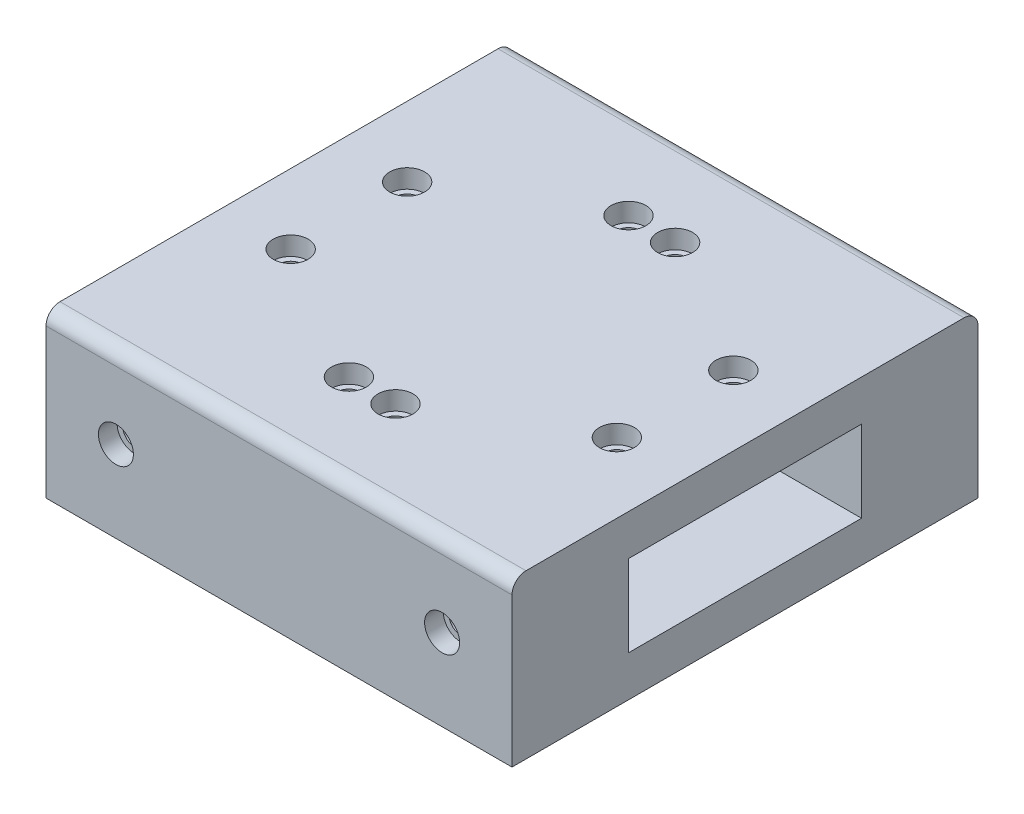
from build123d import *

# Parameters (mm, degrees)
SKETCH1_W           = 100
SKETCH1_H           = 100
BOSS_EXTRUDE1_DEPTH = 35
SKETCH2_W           = 50
SKETCH2_H           = 17.5
CUT_EXTRUDE1_DEPTH  = 30
SKETCH3_R           = 2.5
CUT_EXTRUDE2_DEPTH  = 10
SKETCH4_R           = 3.75
CUT_EXTRUDE3_DEPTH  = 4
SKETCH5_R           = 2.5
CUT_EXTRUDE4_DEPTH  = 30
SKETCH6_R           = 3.75
CUT_EXTRUDE5_DEPTH  = 4
SKETCH7_R           = 2.5
CUT_EXTRUDE10_DEPTH = 79.89866919
SKETCH8_R           = 3.75
CUT_EXTRUDE11_DEPTH = 4
FILLET1_R           = 3


with BuildPart() as part:
    # Sketch1 → Boss-Extrude1 (new body)
    with BuildSketch(Plane(origin=(0, 0, 0), x_dir=(1, 0, 0), z_dir=(0, 1, 0))):
        Rectangle(SKETCH1_W, SKETCH1_H)
    extrude(amount=BOSS_EXTRUDE1_DEPTH)

    # Sketch2 → Cut-Extrude1 (cut)
    with BuildSketch(Plane(origin=(50, 0, 0), x_dir=(0, 0, -1), z_dir=(1, 0, 0))):
        with Locations((0, 17.5)):
            Rectangle(SKETCH2_W, SKETCH2_H)
    cut_extrude1 = extrude(amount=-CUT_EXTRUDE1_DEPTH, mode=Mode.SUBTRACT)

    # Mirror1: Cut-Extrude1 across plane
    add(cut_extrude1.mirror(Plane(origin=(0, 0, 0), x_dir=(0, 0, 1), z_dir=(1, 0, 0))), mode=Mode.SUBTRACT)

    # Sketch3 → Cut-Extrude2 (cut)
    with BuildSketch(Plane(origin=(0, 35, 0), x_dir=(1, 0, 0), z_dir=(0, 1, 0))):
        with Locations(Location((35, 12.5, 0), (0, 0, 270))):
            Circle(SKETCH3_R)
        with Locations(Location((35, -12.5, 0), (0, 0, 270))):
            Circle(SKETCH3_R)
        with Locations(Location((-35, -12.5, 0), (0, 0, 270))):
            Circle(SKETCH3_R)
        with Locations(Location((-35, 12.5, 0), (0, 0, 90))):
            Circle(SKETCH3_R)
    extrude(amount=-CUT_EXTRUDE2_DEPTH, mode=Mode.SUBTRACT)

    # Sketch4 → Cut-Extrude3 (cut)
    with BuildSketch(Plane(origin=(0, 35, 0), x_dir=(1, 0, 0), z_dir=(0, 1, 0))):
        with Locations(Location((35, 12.5, 0), (0, 0, 270))):
            Circle(SKETCH4_R)
        with Locations(Location((35, -12.5, 0), (0, 0, 90))):
            Circle(SKETCH4_R)
        with Locations(Location((-35, -12.5, 0), (0, 0, 270))):
            Circle(SKETCH4_R)
        with Locations(Location((-35, 12.5, 0), (0, 0, 90))):
            Circle(SKETCH4_R)
    extrude(amount=-CUT_EXTRUDE3_DEPTH, mode=Mode.SUBTRACT)

    # Sketch5 → Cut-Extrude4 (cut)
    with BuildSketch(Plane(origin=(0, 0, -50), x_dir=(-1, 0, 0), z_dir=(0, 0, -1))):
        with Locations((-35, 17.5)):
            Circle(SKETCH5_R)
        with Locations(Location((35, 17.5, 0), (0, 0, 270))):
            Circle(SKETCH5_R)
    cut_extrude4 = extrude(amount=-CUT_EXTRUDE4_DEPTH, mode=Mode.SUBTRACT)

    # Sketch6 → Cut-Extrude5 (cut)
    with BuildSketch(Plane(origin=(0, 0, -50), x_dir=(-1, 0, 0), z_dir=(0, 0, -1))):
        with Locations((-35, 17.5)):
            Circle(SKETCH6_R)
        with Locations(Location((35, 17.5, 0), (0, 0, 180))):
            Circle(SKETCH6_R)
    cut_extrude5 = extrude(amount=-CUT_EXTRUDE5_DEPTH, mode=Mode.SUBTRACT)

    # Mirror2: Cut-Extrude4, Cut-Extrude5 across plane
    add(cut_extrude4.mirror(Plane.XY), mode=Mode.SUBTRACT)
    add(cut_extrude5.mirror(Plane.XY), mode=Mode.SUBTRACT)

    # Sketch7 → Cut-Extrude10 (cut, through all)
    with BuildSketch(Plane(origin=(0, 35, 0), x_dir=(1, 0, 0), z_dir=(0, 1, 0))):
        with Locations(Location((5, 30, 0), (0, 0, 270))):
            Circle(SKETCH7_R)
        with Locations(Location((5, -30, 0), (0, 0, 90))):
            Circle(SKETCH7_R)
        with Locations(Location((-5, -30, 0), (0, 0, 270))):
            Circle(SKETCH7_R)
        with Locations(Location((-5, 30, 0), (0, 0, 90))):
            Circle(SKETCH7_R)
    extrude(amount=-CUT_EXTRUDE10_DEPTH, mode=Mode.SUBTRACT)

    # Sketch8 → Cut-Extrude11 (cut)
    with BuildSketch(Plane(origin=(0, 35, 0), x_dir=(1, 0, 0), z_dir=(0, 1, 0))):
        with Locations(Location((-5, 30, 0), (0, 0, 270))):
            Circle(SKETCH8_R)
        with Locations(Location((5, 30, 0), (0, 0, 90))):
            Circle(SKETCH8_R)
        with Locations(Location((5, -30, 0), (0, 0, 270))):
            Circle(SKETCH8_R)
        with Locations(Location((-5, -30, 0), (0, 0, 90))):
            Circle(SKETCH8_R)
    extrude(amount=-CUT_EXTRUDE11_DEPTH, mode=Mode.SUBTRACT)

    # Fillet1
    fillet1_edges = [part.edges().sort_by_distance(p)[0] for p in [
        (0, 35, 50),
        (0, 35, -50),
    ]]
    fillet(fillet1_edges, radius=FILLET1_R)


solid = part.part
